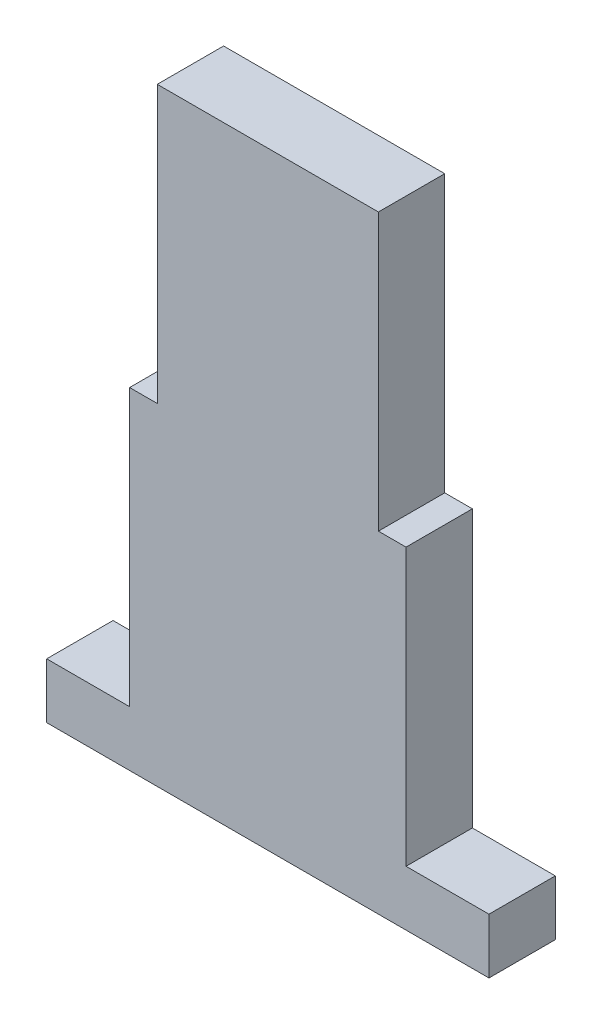
from build123d import *

# Parameters (mm, degrees)
BOSS_EXTRUDE1_DEPTH = 0.6


with BuildPart() as part:
    # Sketch1 → Boss-Extrude1 (new, symmetric)
    with BuildSketch(Plane.XY):
        Polygon((-2.5, 0), (-2.5, 5), (-2, 5), (-2, 10), (2, 10), (2, 5), (2.5, 5), (2.5, 0), (4, 0), (4, -1), (-4, -1), (-4, 0), align=None)
    extrude(amount=BOSS_EXTRUDE1_DEPTH, both=True)


solid = part.part
